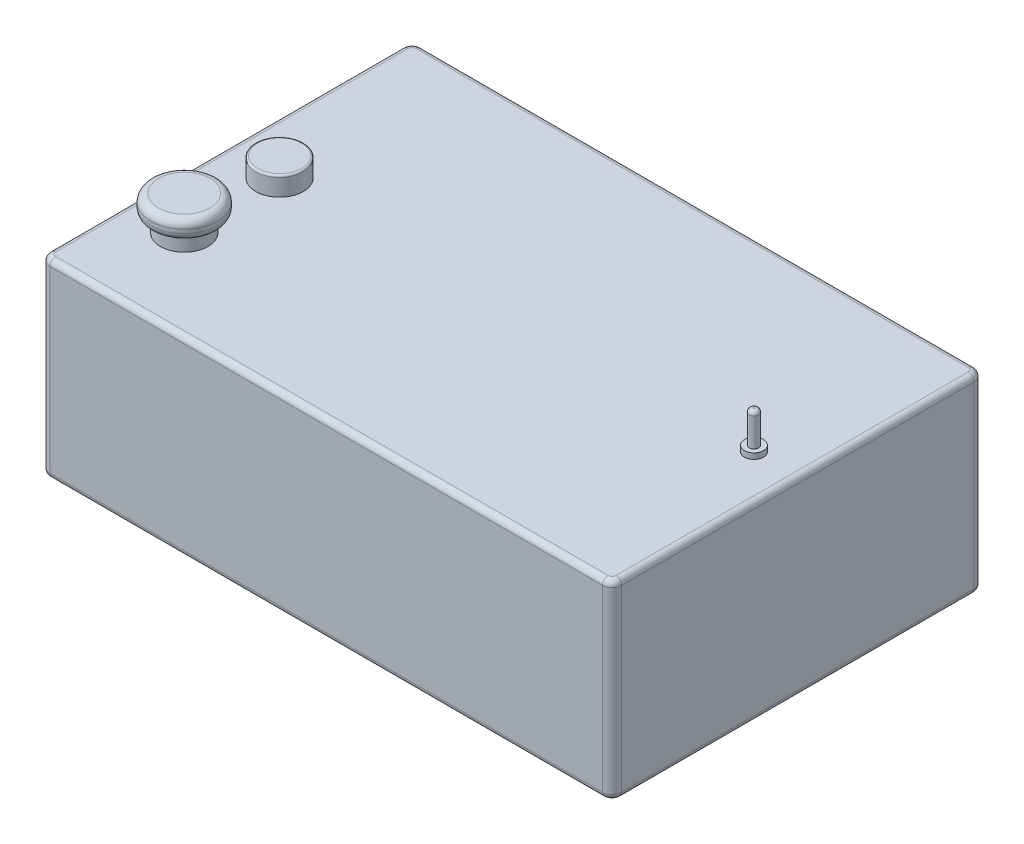
from build123d import *

# Parameters (mm, degrees)
BOSS_EXTRUDE1_DEPTH = 100
FILLET3_R           = 3
SKETCH3_R           = 12.5
BOSS_EXTRUDE2_DEPTH = 10
SKETCH4_R           = 12.5
BOSS_EXTRUDE3_DEPTH = 8
SKETCH5_R           = 17.5
BOSS_EXTRUDE5_DEPTH = 10
FILLET6_R           = 4
FILLET7_R           = 1
SKETCH6_R           = 5
BOSS_EXTRUDE6_DEPTH = 3
SKETCH7_R           = 2.5
BOSS_EXTRUDE7_DEPTH = 17
FILLET13_R          = 2


with BuildPart() as part:
    # Sketch2 → Boss-Extrude1 (new body)
    with BuildSketch(Plane(origin=(0, 0, 0), x_dir=(1, 0, 0), z_dir=(0, 1, 0))):
        with BuildLine():
            Line((-145, 97.5), (145, 97.5))
            ThreePointArc((145, 97.5), (148.535533906, 96.035533906), (150, 92.5))
            Line((150, 92.5), (150, -92.5))
            ThreePointArc((150, -92.5), (148.535533906, -96.035533906), (145, -97.5))
            Line((145, -97.5), (-145, -97.5))
            ThreePointArc((-145, -97.5), (-148.535533906, -96.035533906), (-150, -92.5))
            Line((-150, -92.5), (-150, 92.5))
            ThreePointArc((-150, 92.5), (-148.535533906, 96.035533906), (-145, 97.5))
        make_face()
    extrude(amount=BOSS_EXTRUDE1_DEPTH)

    # Fillet3
    fillet3_edges = [part.edges().sort_by_distance(p)[0] for p in [
        (150, 0, 0),
        (148.535533906, 0, 96.035533906),
        (0, 0, 97.5),
        (-148.535533906, 0, 96.035533906),
        (148.535533906, 100, 96.035533906),
        (150, 100, 0),
        (148.535533906, 100, -96.035533906),
        (0, 100, -97.5),
        (-148.535533906, 100, -96.035533906),
        (-150, 100, 0),
        (-148.535533906, 100, 96.035533906),
        (-150, 0, 0),
        (0, 100, 97.5),
        (-148.535533906, 0, -96.035533906),
        (0, 0, -97.5),
        (148.535533906, 0, -96.035533906),
    ]]
    fillet(fillet3_edges, radius=FILLET3_R)

    # Sketch3 → Boss-Extrude2 (add)
    with BuildSketch(Plane(origin=(0, 100, 0), x_dir=(1, 0, 0), z_dir=(0, 1, 0))):
        with Locations(Location((-122, 0, 0), (0, 0, 270))):
            Circle(SKETCH3_R)
    extrude(amount=BOSS_EXTRUDE2_DEPTH)

    # Sketch4 → Boss-Extrude3 (add)
    with BuildSketch(Plane(origin=(0, 100, 0), x_dir=(1, 0, 0), z_dir=(0, 1, 0))):
        with Locations(Location((-122, -50, 0), (0, 0, 270))):
            Circle(SKETCH4_R)
    extrude(amount=BOSS_EXTRUDE3_DEPTH)

    # Sketch5 → Boss-Extrude5 (add)
    with BuildSketch(Plane(origin=(0, 108, 0), x_dir=(1, 0, 0), z_dir=(0, 1, 0))):
        with Locations(Location((-122, -50, 0), (0, 0, 270))):
            Circle(SKETCH5_R)
    extrude(amount=BOSS_EXTRUDE5_DEPTH)

    # Fillet6
    fillet6_edges = [part.edges().sort_by_distance(p)[0] for p in [
        (-122, 108, 32.5),
        (-122, 118, 32.5),
    ]]
    fillet(fillet6_edges, radius=FILLET6_R)

    # Fillet7
    fillet7_edges = [part.edges().sort_by_distance(p)[0] for p in [
        (-122, 110, -12.5),
    ]]
    fillet(fillet7_edges, radius=FILLET7_R)

    # Sketch6 → Boss-Extrude6 (add)
    with BuildSketch(Plane(origin=(0, 100, 0), x_dir=(1, 0, 0), z_dir=(0, 1, 0))):
        with Locations(Location((127, 0, 0), (0, 0, 270))):
            Circle(SKETCH6_R)
    extrude(amount=BOSS_EXTRUDE6_DEPTH)

    # Sketch7 → Boss-Extrude7 (add)
    with BuildSketch(Plane(origin=(0, 103, 0), x_dir=(1, 0, 0), z_dir=(0, 1, 0))):
        with Locations(Location((127, 0, 0), (0, 0, 270))):
            Circle(SKETCH7_R)
    extrude(amount=BOSS_EXTRUDE7_DEPTH)

    # Fillet13
    fillet13_edges = [part.edges().sort_by_distance(p)[0] for p in [
        (127, 120, -2.5),
    ]]
    fillet(fillet13_edges, radius=FILLET13_R)


solid = part.part
